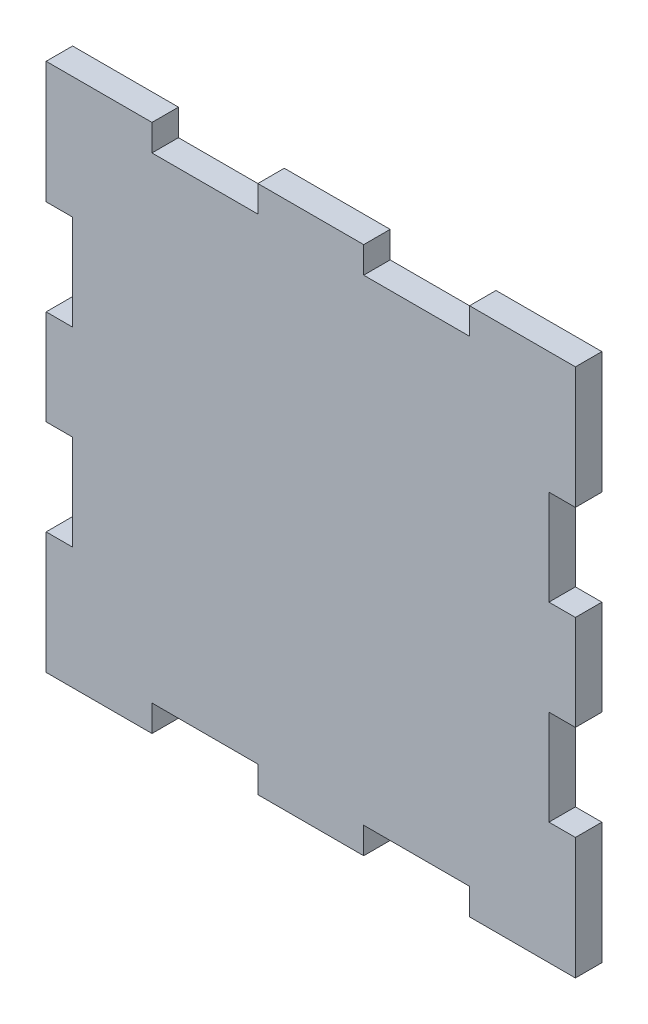
from build123d import *

# Parameters (mm, degrees)
ESQUISSE1_W             = 100
ESQUISSE1_H             = 100
BOSS_EXTRU_1_DEPTH      = 5
ESQUISSE2_W             = 20
ESQUISSE2_H             = 5
ESQUISSE2_W_2           = 5
ESQUISSE2_H_2           = 18
ENL_V_MAT_EXTRU_1_DEPTH = 5


with BuildPart() as part:
    # Esquisse1 → Boss.-Extru.1 (new body)
    with BuildSketch(Plane.XY):
        with Locations((-50, -50)):
            Rectangle(ESQUISSE1_W, ESQUISSE1_H)
    extrude(amount=BOSS_EXTRU_1_DEPTH)

    # Esquisse2 → Enlèv. mat.-Extru.1 (cut)
    with BuildSketch(Plane(origin=(0, 0, 0), x_dir=(-1, 0, 0), z_dir=(0, 0, -1))):
        with Locations((70, -97.5)):
            Rectangle(ESQUISSE2_W, ESQUISSE2_H)
        with Locations((30, -97.5)):
            Rectangle(ESQUISSE2_W, ESQUISSE2_H)
        with Locations((30, -2.5)):
            Rectangle(ESQUISSE2_W, ESQUISSE2_H)
        with Locations((70, -2.5)):
            Rectangle(ESQUISSE2_W, ESQUISSE2_H)
        with Locations((97.5, -68)):
            Rectangle(ESQUISSE2_W_2, ESQUISSE2_H_2)
        with Locations((97.5, -32)):
            Rectangle(ESQUISSE2_W_2, ESQUISSE2_H_2)
        with Locations((2.5, -32)):
            Rectangle(ESQUISSE2_W_2, ESQUISSE2_H_2)
        with Locations((2.5, -68)):
            Rectangle(ESQUISSE2_W_2, ESQUISSE2_H_2)
    extrude(amount=-ENL_V_MAT_EXTRU_1_DEPTH, mode=Mode.SUBTRACT)


solid = part.part
